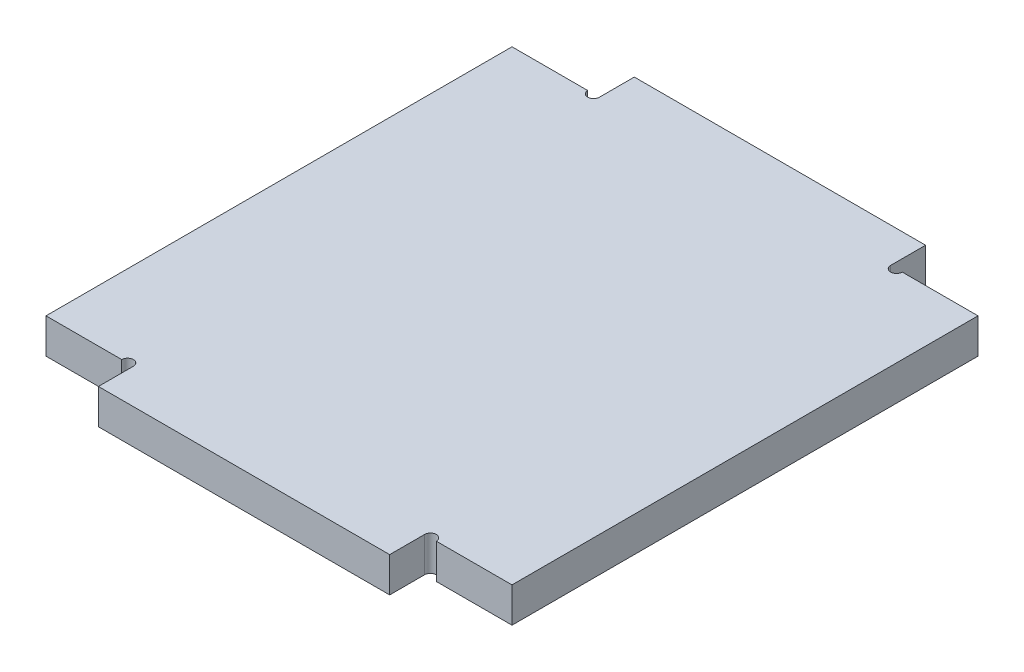
from build123d import *

# Parameters (mm, degrees)
BOSS_EXTRUDE1_DEPTH = 3


with BuildPart() as part:
    # Sketch1 → Boss-Extrude1 (new body)
    with BuildSketch(Plane(origin=(0, 0, 0), x_dir=(1, 0, 0), z_dir=(0, 1, 0))):
        with BuildLine():
            Line((0, 0), (6.5, 0))
            ThreePointArc((6.5, 0), (7, 0.5), (7.5, 0))
            Line((7.5, 0), (7.5, -3))
            Line((7.5, -3), (32.5, -3))
            Line((32.5, -3), (32.5, 0))
            ThreePointArc((32.5, 0), (33, 0.5), (33.5, 0))
            Line((33.5, 0), (40, 0))
            Line((40, 0), (40, 40))
            Line((40, 40), (33.5, 40))
            ThreePointArc((33.5, 40), (33, 39.5), (32.5, 40))
            Line((32.5, 40), (32.5, 43))
            Line((32.5, 43), (7.5, 43))
            Line((7.5, 43), (7.5, 40))
            ThreePointArc((7.5, 40), (7, 39.5), (6.5, 40))
            Line((6.5, 40), (0, 40))
            Line((0, 40), (0, 0))
        make_face()
    extrude(amount=BOSS_EXTRUDE1_DEPTH)


solid = part.part
